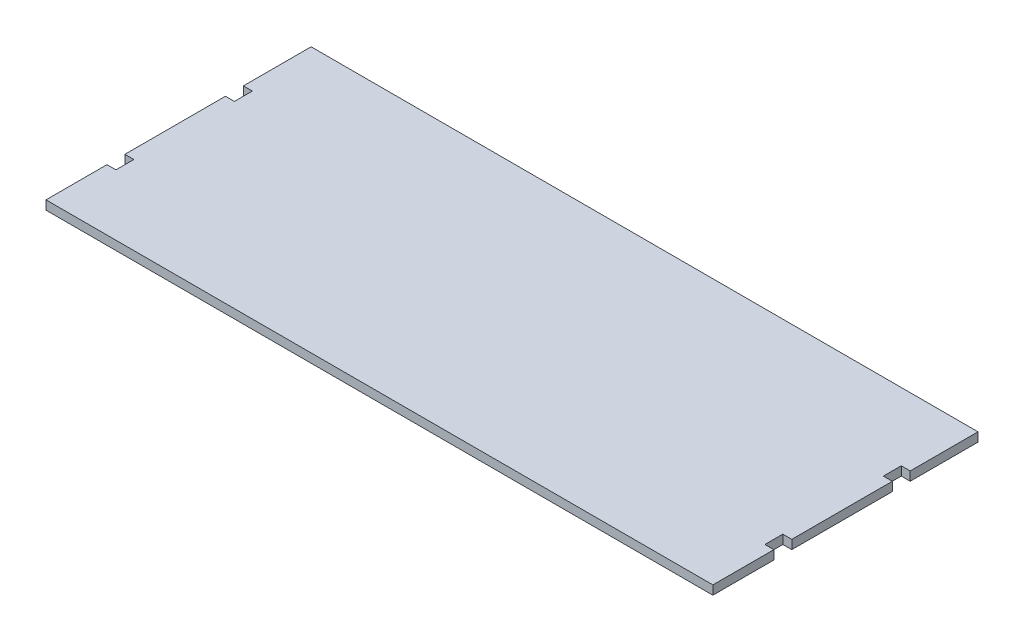
from build123d import *

# Parameters (mm, degrees)
BOSS_EXTRUDE1_DEPTH = 5


with BuildPart() as part:
    # Sketch1 → Boss-Extrude1 (new body)
    with BuildSketch(Plane(origin=(0, 0, 0), x_dir=(1, 0, 0), z_dir=(0, 1, 0))):
        Polygon((-186, 36.145), (-181, 36.145), (-181, 26.145), (-186, 26.145), (-186, -29.945), (-181, -29.945), (-181, -39.945), (-186, -39.945), (-186, -73.945), (186, -73.945), (186, -39.945), (181, -39.945), (181, -29.945), (186, -29.945), (186, 26.145), (181, 26.145), (181, 36.145), (186, 36.145), (186, 73.945), (-186, 73.945), align=None)
    extrude(amount=BOSS_EXTRUDE1_DEPTH)


solid = part.part
